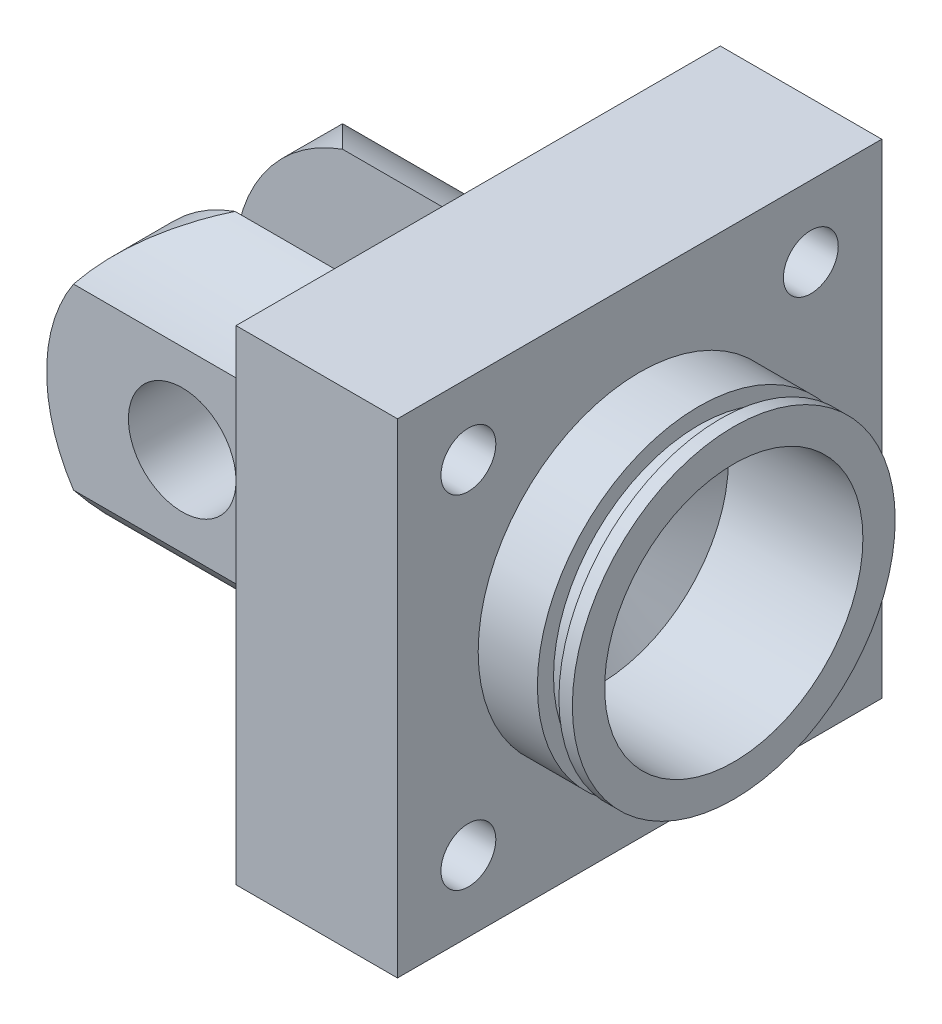
from build123d import *

# Parameters (mm, degrees)
SKETCH1_W                          = 55.2
SKETCH1_H                          = 30
SKETCH2_W                          = 90
SKETCH2_H                          = 90
BOSS_EXTRUDE1_DEPTH                = 30
SKETCH8_W                          = 96.2
SKETCH8_H                          = 30
SKETCH11_W                         = 100.2
SKETCH11_H                         = 27
SKETCH15_W                         = 2.5
SKETCH15_H                         = 30
SKETCH16_W                         = 20
SKETCH16_H                         = 71.644187242
CUT_EXTRUDE1_DEPTH                 = 55.2
SKETCH17_OUTSIDE_W                 = 124.71
SKETCH17_OUTSIDE_H                 = 124.71
SKETCH17_OUTSIDE_W_2               = 50
SKETCH17_OUTSIDE_H_2               = 73.870600334
CUT_EXTRUDE2_DEPTH                 = 55.2
SKETCH19_R                         = 10
CUT_EXTRUDE3_DEPTH                 = 133.182790105
CUT_EXTRUDE4_DEPTH                 = 133.182790105
TAP_DRILL_FOR_M1_2X0_25_TAP2_D     = 48
TAP_DRILL_FOR_M1_2X0_25_TAP2_DEPTH = 25
TAP_DRILL_FOR_M1_2X0_25_TAP2_TIP   = 14.420654857
CIRPATTERN1_COUNT                  = 4
M16X1_5_TAPPED_HOLE3_D             = 14.5
M16X1_5_TAPPED_HOLE3_DEPTH         = 16
M16X1_5_TAPPED_HOLE3_TIP           = 4.356239488
CUT_EXTRUDE5_REACH                 = 145.779
SKETCH45_R                         = 1.7


with BuildPart() as part:
    # Sketch1 → Revolve-Thin1 (revolve)
    with BuildSketch(Plane.XY):
        with Locations((27.6, 15)):
            Rectangle(SKETCH1_W, SKETCH1_H)
    revolve(axis=Axis((0, 0, 0), (1, 0, 0)))

    # Sketch2 → Boss-Extrude1 (add)
    with BuildSketch(Plane(origin=(55.2, 0, 0), x_dir=(0, 0, -1), z_dir=(1, 0, 0))):
        Rectangle(SKETCH2_W, SKETCH2_H)
    extrude(amount=BOSS_EXTRUDE1_DEPTH)

    # Sketch8 → Revolve-Thin2 (revolve)
    with BuildSketch(Plane.XY):
        with Locations((48.1, 15)):
            Rectangle(SKETCH8_W, SKETCH8_H)
    revolve(axis=Axis((0, 0, 0), (1, 0, 0)))

    # Sketch11 → Revolve-Thin3 (revolve)
    with BuildSketch(Plane(origin=(0, 0, 0), x_dir=(1, 0, 0), z_dir=(0, 1, 0))):
        with Locations((50.1, 13.5)):
            Rectangle(SKETCH11_W, SKETCH11_H)
    revolve(axis=Axis((0, 0, 0), (1, 0, 0)))

    # Sketch15 → Revolve-Thin4 (revolve)
    with BuildSketch(Plane.XY):
        with Locations((101.45, 15)):
            Rectangle(SKETCH15_W, SKETCH15_H)
    revolve(axis=Axis((100.2, 0, 0), (1, 0, 0)))

    # Sketch16 → Cut-Extrude1 (cut)
    with BuildSketch(Plane.ZY):
        Rectangle(SKETCH16_W, SKETCH16_H)
    extrude(amount=-CUT_EXTRUDE1_DEPTH, mode=Mode.SUBTRACT)

    # Sketch17 outside → Cut-Extrude2 (cut)
    with BuildSketch(Plane.ZY):
        Rectangle(SKETCH17_OUTSIDE_W, SKETCH17_OUTSIDE_H)
        Rectangle(SKETCH17_OUTSIDE_W_2, SKETCH17_OUTSIDE_H_2, mode=Mode.SUBTRACT)
    extrude(amount=-CUT_EXTRUDE2_DEPTH, mode=Mode.SUBTRACT)

    # Sketch19 → Cut-Extrude3 (cut, through all)
    with BuildSketch(Plane.XY.offset(25)):
        with Locations((25.2, 0)):
            Circle(SKETCH19_R)
    extrude(amount=-CUT_EXTRUDE3_DEPTH, mode=Mode.SUBTRACT)

    # Sketch22 → Cut-Extrude4 (cut, through all)
    with BuildSketch(Plane(origin=(0, 0, -25), x_dir=(-1, 0, 0), z_dir=(0, 0, -1))):
        with BuildLine():
            Line((9.98487255, 34.360502565), (-23.649851102, 34.360502565))
            Line((-23.649851102, 34.360502565), (-23.649851102, 29.320225254))
            ThreePointArc((-23.649851102, 29.320225254), (0, 0), (-23.649851102, -29.320225254))
            Line((-23.649851102, -29.320225254), (-23.649851102, -35.668103598))
            Line((-23.649851102, -35.668103598), (9.98487255, -35.668103598))
            Line((9.98487255, -35.668103598), (9.98487255, 34.360502565))
        make_face()
    extrude(amount=-CUT_EXTRUDE4_DEPTH, mode=Mode.SUBTRACT)

    # Tap Drill for M1.2x0.25 Tap2
    with Locations(Plane(origin=(102.7, 0, 0), x_dir=(0, 0, -1), z_dir=(1, 0, 0))):
        with Locations((0, 0)):
            Hole(TAP_DRILL_FOR_M1_2X0_25_TAP2_D / 2, depth=TAP_DRILL_FOR_M1_2X0_25_TAP2_DEPTH)
            with Locations((0, 0, -(TAP_DRILL_FOR_M1_2X0_25_TAP2_DEPTH + TAP_DRILL_FOR_M1_2X0_25_TAP2_TIP / 2))):  # 118° drill point
                Cone(0, TAP_DRILL_FOR_M1_2X0_25_TAP2_D / 2, TAP_DRILL_FOR_M1_2X0_25_TAP2_TIP, mode=Mode.SUBTRACT)

    # Sketch32 → M12 Tapped Hole2 (revolve, cut)
    with BuildSketch(Plane(origin=(85.2, -31.819805153, 31.819805153), x_dir=(0, 0, -1), z_dir=(0, 1, 0))):
        Polygon((0, 0), (0, 23.064389157), (5.1, 20), (5.1, 0), align=None)
    m12_tapped_hole2 = revolve(axis=Axis((91.55, -31.819805153, 31.819805153), (-1, 0, 0)), mode=Mode.SUBTRACT)

    # CirPattern1: M12 Tapped Hole2 ×4 about axis
    cirpattern1_axis = Axis((77.7, 0, 0), (-1, 0, 0))
    for i in range(1, CIRPATTERN1_COUNT):
        add(m12_tapped_hole2.rotate(cirpattern1_axis, i * 360 / CIRPATTERN1_COUNT), mode=Mode.SUBTRACT)

    # M16x1.5 Tapped Hole3
    with Locations(Plane(origin=(70.2, -45, 0), x_dir=(0, 0, -1), z_dir=(0, -1, 0))):
        with Locations((0, 0)):
            Hole(M16X1_5_TAPPED_HOLE3_D / 2, depth=M16X1_5_TAPPED_HOLE3_DEPTH)
            with Locations((0, 0, -(M16X1_5_TAPPED_HOLE3_DEPTH + M16X1_5_TAPPED_HOLE3_TIP / 2))):  # 118° drill point
                Cone(0, M16X1_5_TAPPED_HOLE3_D / 2, M16X1_5_TAPPED_HOLE3_TIP, mode=Mode.SUBTRACT)

    # Sketch45 → Cut-Extrude5 (cut, up to next)
    with BuildSketch(Plane.XZ.offset(45), mode=Mode.PRIVATE) as cut_extrude5_sk1:
        with Locations((70.2, 0)):
            Circle(SKETCH45_R)
    cut_extrude5_tool1 = extrude(cut_extrude5_sk1.sketch, amount=-CUT_EXTRUDE5_REACH, mode=Mode.PRIVATE) & part.part
    add(cut_extrude5_tool1.solids().sort_by_distance((70.2, -45, 0))[0], mode=Mode.SUBTRACT)


solid = part.part
